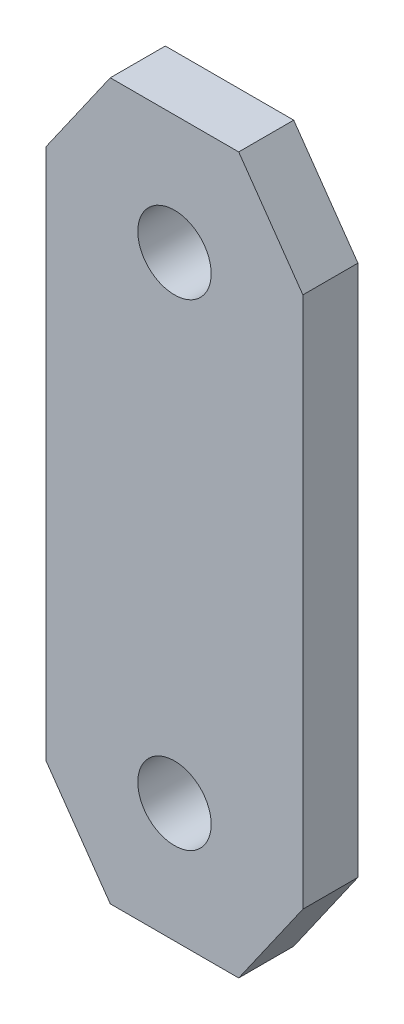
from build123d import *

# Parameters (mm, degrees)
DODANIE_WYCI_GNI_CIE1_DEPTH = 3
SZKIC2_R                    = 2
WYTNIJ_WYCI_GNI_CIE1_DEPTH  = 3


with BuildPart() as part:
    # Szkic1 → Dodanie-wyciągnięcie1 (new body)
    with BuildSketch(Plane.XY):
        Polygon((7, 14.5), (3.5, 19.5), (-3.5, 19.5), (-7, 14.5), (-7, -14.5), (-3.5, -19.5), (3.5, -19.5), (7, -14.5), align=None)
    extrude(amount=DODANIE_WYCI_GNI_CIE1_DEPTH)

    # Szkic2 → Wytnij-wyciągnięcie1 (cut)
    with BuildSketch(Plane.XY.offset(3)):
        with Locations((0, 13)):
            Circle(SZKIC2_R)
        with Locations((0, -13)):
            Circle(SZKIC2_R)
    extrude(amount=-WYTNIJ_WYCI_GNI_CIE1_DEPTH, mode=Mode.SUBTRACT)


solid = part.part
